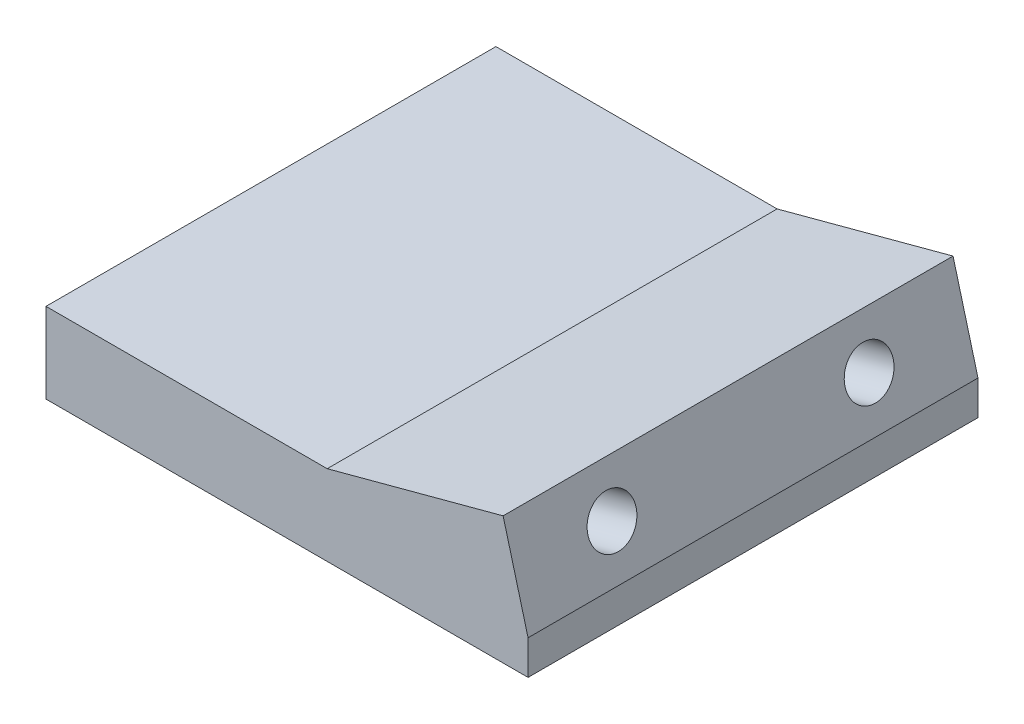
from build123d import *

# Parameters (mm, degrees)
BOSS_EXTRUDE1_DEPTH          = 44.45
F_3_8_0_375_DIAMETER_HOLE1_D = 9.525


with BuildPart() as part:
    # Sketch1 → Boss-Extrude1 (new, symmetric)
    with BuildSketch(Plane.XY):
        Polygon((95.25, 0), (95.25, 6.787222338), (90.319497191, 25.188109329), (55.5625, 15.875), (0, 15.875), (0, 0), align=None)
    extrude(amount=BOSS_EXTRUDE1_DEPTH, both=True)

    # 3/8 (0.375) Diameter Hole1 (through all)
    with Locations(Plane(origin=(90.56626544, 24.267157686, 0), x_dir=(0, 0, -1), z_dir=(0.9659258262890682, 0.2588190451025212, 0))):
        with Locations((-25.4, -8.571560701), (25.4, -8.571560701)):
            Hole(F_3_8_0_375_DIAMETER_HOLE1_D / 2)


solid = part.part
